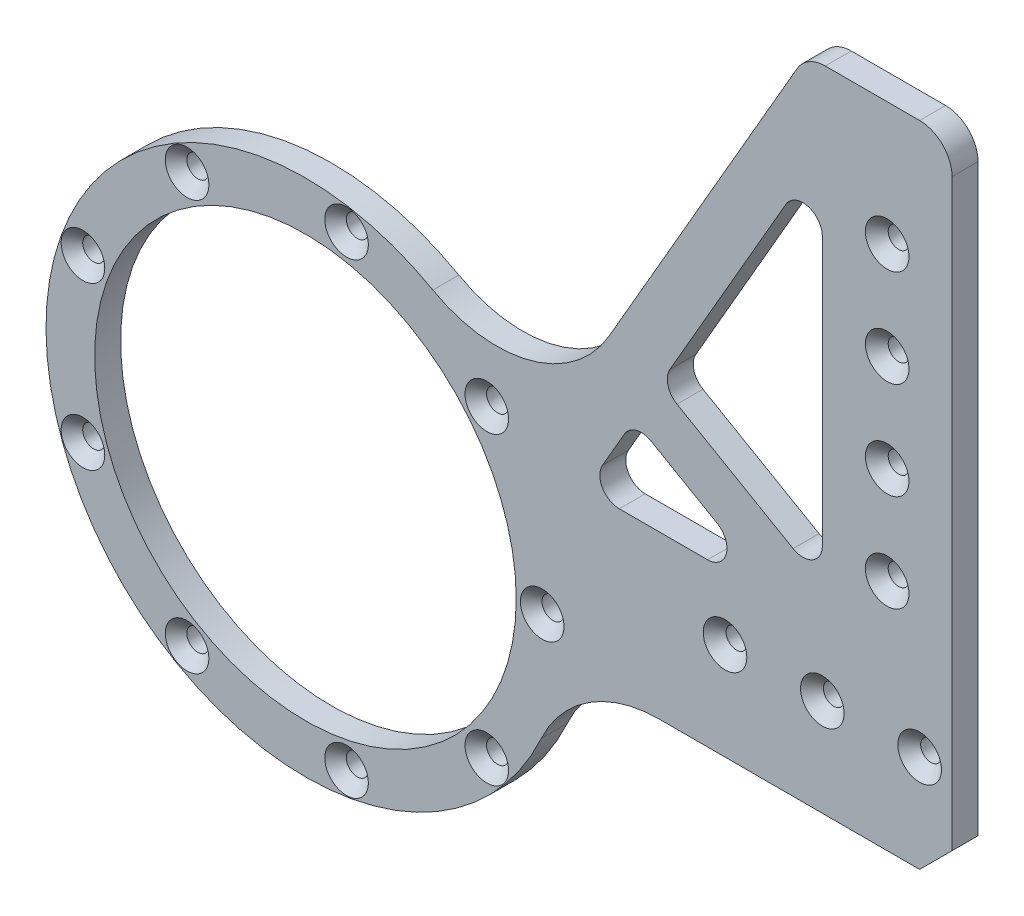
from build123d import *

# Parameters (mm, degrees)
SKETCH_1_R                   = 40
SKETCH_1_R_2                 = 32.5
EXTRUDE_1_DEPTH              = 4
HOLE_WIZARD_M3_1_D           = 3.4
HOLE_WIZARD_M3_1_CSINK_D     = 6.72
HOLE_WIZARD_M3_1_CSINK_ANGLE = 90
EXTRUDE_START                = -4
EXTRUDE_2_DEPTH              = 4
FILLET_2_R                   = 20
CHAMFER_1_SIZE               = 5
FILLET_4_R                   = 3
FILLET_5_R                   = 5
HOLE_WIZARD_M3_3_D           = 3.2
HOLE_WIZARD_M3_3_CSINK_D     = 6.72
HOLE_WIZARD_M3_3_CSINK_ANGLE = 90


with BuildPart() as part:
    # 草图1 → 凸台-拉伸1 (new body)
    with BuildSketch(Plane.XY):
        Circle(SKETCH_1_R)
        Circle(SKETCH_1_R_2, mode=Mode.SUBTRACT)
    extrude(amount=EXTRUDE_1_DEPTH)

    # M3 六角凹锥坑螺钉的锥形沉头孔1 (through all)
    with Locations(Plane.XY.offset(4)):
        with Locations((27.960622174, 23.461747754), (36.5, 0), (27.960622174, -23.461747754), (6.338158485, -35.945482985), (-18.25, -31.609927238), (-34.298780659, -12.483735231), (-34.298780659, 12.483735231), (-18.25, 31.609927238), (6.338158485, 35.945482985)):
            CounterSinkHole(HOLE_WIZARD_M3_1_D / 2, HOLE_WIZARD_M3_1_CSINK_D / 2, counter_sink_angle=HOLE_WIZARD_M3_1_CSINK_ANGLE)

    # 草图4 → 凸台-拉伸2 (add)
    with BuildSketch(Plane.XY.offset(4).offset(EXTRUDE_START)):
        with BuildLine():
            Line((39.686269666, -5), (99.686269666, -5))
            Line((99.686269666, -5), (99.686269666, 95))
            Line((99.686269666, 95), (77.249935548, 95))
            Line((77.249935548, 95), (34.29141524, 20.593660209))
            ThreePointArc((34.29141524, 20.593660209), (39.139919861, 8.25025292), (39.686269666, -5))
        make_face()
        Polygon((54.686269666, 39.918584287), (79.686269666, 25.484827557), (79.686269666, 83.219854476), align=None, mode=Mode.SUBTRACT)
        Polygon((50.686269666, 32.990381057), (73.186269666, 20), (43.186269666, 20), align=None, mode=Mode.SUBTRACT)
    extrude(amount=EXTRUDE_2_DEPTH)

    # 圆角2
    fillet_2_edges = [part.edges().sort_by_distance(p)[0] for p in [
        (34.29141524, 20.593660209, 2),
        (39.686269666, -5, 2),
    ]]
    fillet(fillet_2_edges, radius=FILLET_2_R)

    # 倒角1
    chamfer_1_edges = [part.edges().sort_by_distance(p)[0] for p in [
        (99.686269666, -5, 2),
    ]]
    chamfer(chamfer_1_edges, length=CHAMFER_1_SIZE)

    # 圆角4
    fillet_4_edges = [part.edges().sort_by_distance(p)[0] for p in [
        (54.686269666, 39.918584287, 2),
        (79.686269666, 25.484827557, 2),
        (79.686269666, 83.219854476, 2),
        (73.186269666, 20, 2),
        (50.686269666, 32.990381057, 2),
        (43.186269666, 20, 2),
    ]]
    fillet(fillet_4_edges, radius=FILLET_4_R)

    # 圆角5
    fillet_5_edges = [part.edges().sort_by_distance(p)[0] for p in [
        (77.249935548, 95, 2),
        (99.686269666, 95, 2),
    ]]
    fillet(fillet_5_edges, radius=FILLET_5_R)

    # M3 六角凹锥坑螺钉的锥形沉头孔3 (through all)
    with Locations(Plane.XY.offset(4)):
        with Locations((94.686269666, 10), (89.686269666, 76), (89.686269666, 61), (89.686269666, 46), (89.686269666, 31), (79.686269666, 10), (64.686269666, 10)):
            CounterSinkHole(HOLE_WIZARD_M3_3_D / 2, HOLE_WIZARD_M3_3_CSINK_D / 2, counter_sink_angle=HOLE_WIZARD_M3_3_CSINK_ANGLE)


solid = part.part
